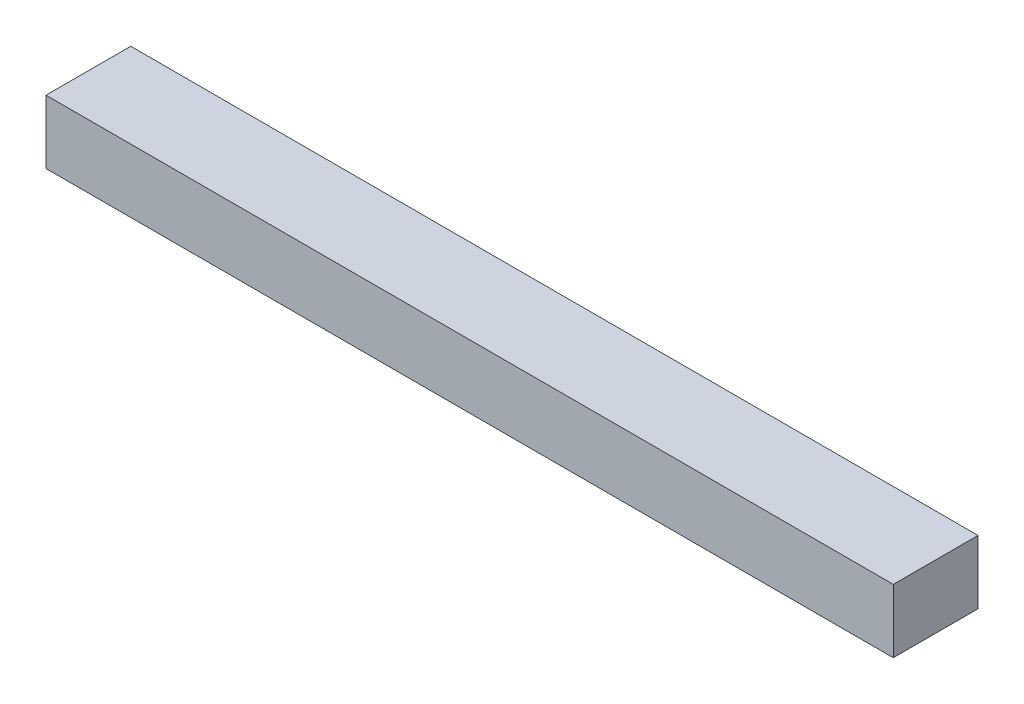
from build123d import *

# Parameters (mm, degrees)
SKETCH2_W      = 10
SKETCH2_H      = 0.75
EXTRUDE1_DEPTH = 1


with BuildPart() as part:
    # Sketch2 → Extrude1 (new body)
    with BuildSketch(Plane.XY):
        with Locations((5, -2.672711334)):
            Rectangle(SKETCH2_W, SKETCH2_H)
    extrude(amount=EXTRUDE1_DEPTH)


solid = part.part
